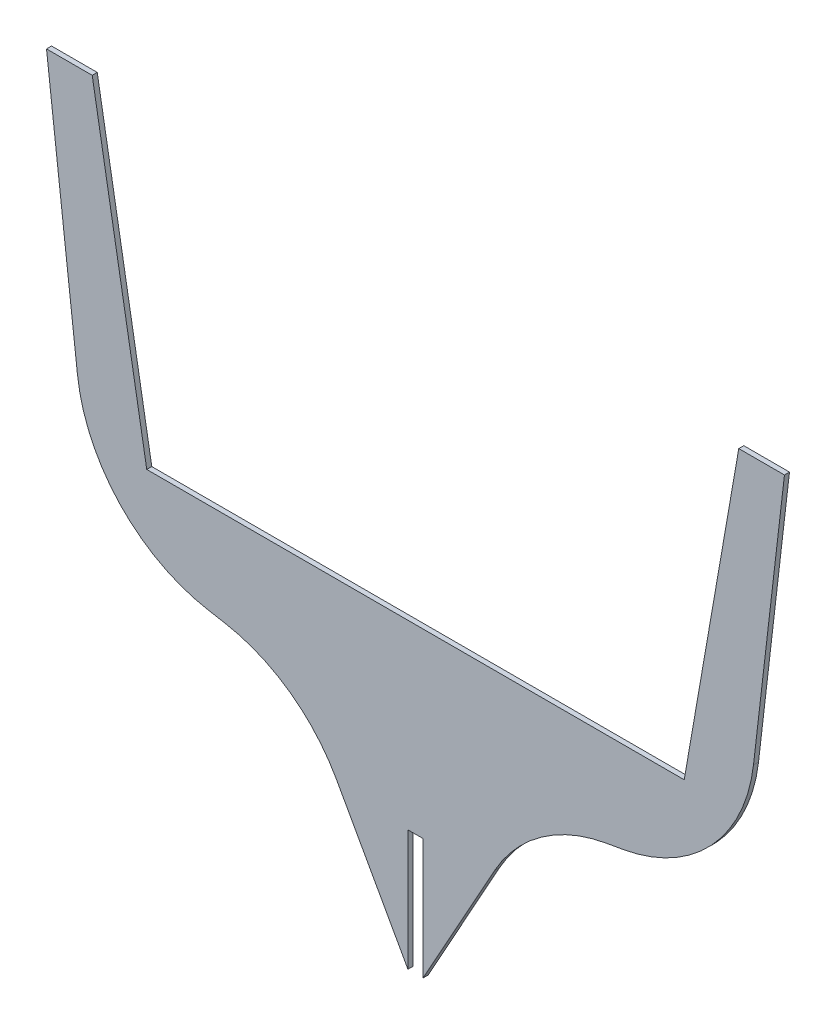
from build123d import *

# Parameters (mm, degrees)
BOSS_EXTRU_3_DEPTH = 3
CONG_1_R           = 95


with BuildPart() as part:
    # Esquisse3 → Boss.-Extru.3 (new body)
    with BuildSketch(Plane.XY):
        Polygon((12.705937195, 123.443580448), (45.234185685, -63.831284152), (365.68267058, -63.831284152), (398.21091907, 123.443580448), (425.458428133, 123.443580448), (398.831601009, -105.784832074), (274.58078198, -127.690915139), (209.958428133, -244.056419552), (209.958428133, -172.056419552), (200.958428133, -172.056419552), (200.958428133, -244.056419552), (136.336074285, -127.690915139), (12.085255256, -105.784832074), (-14.541571867, 123.443580448), align=None)
    extrude(amount=BOSS_EXTRU_3_DEPTH)

    # Congé1
    cong_1_edges = [part.edges().sort_by_distance(p)[0] for p in [
        (136.336074285, -127.690915139, 1.5),
        (12.085255256, -105.784832074, 1.5),
        (398.831601009, -105.784832074, 1.5),
        (274.58078198, -127.690915139, 1.5),
    ]]
    fillet(cong_1_edges, radius=CONG_1_R)


solid = part.part
